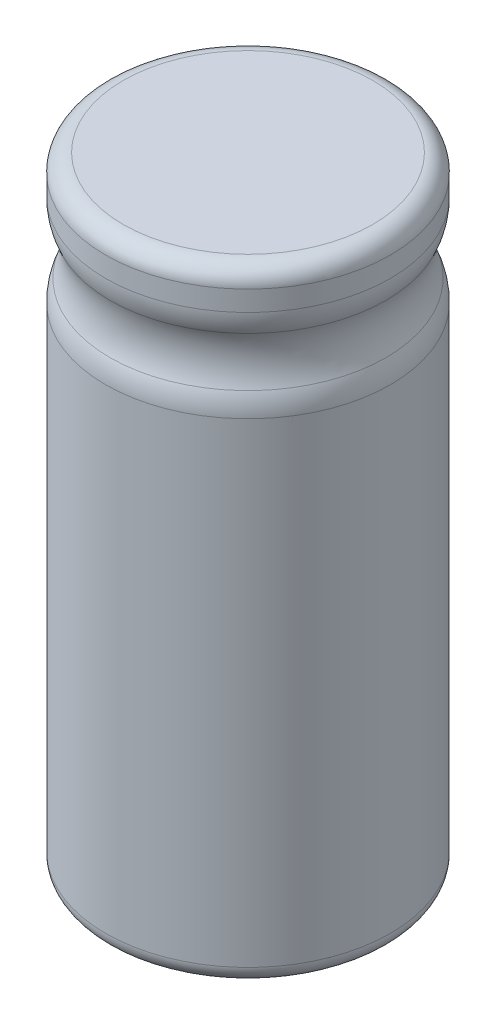
from build123d import *

# Parameters (mm, degrees)
SKETCH1_R           = 16.125
BOSS_EXTRUDE1_DEPTH = 35.25
FILLET1_R           = 2
FILLET2_R           = 6


with BuildPart() as part:
    # Sketch1 → Boss-Extrude1 (new, symmetric)
    with BuildSketch(Plane(origin=(0, 0, 0), x_dir=(1, 0, 0), z_dir=(0, 1, 0))):
        with Locations(Location((0, 0, 0), (0, 0, 270))):
            Circle(SKETCH1_R)
    extrude(amount=BOSS_EXTRUDE1_DEPTH, both=True)

    # Fillet1
    fillet1_edges = [part.edges().sort_by_distance(p)[0] for p in [
        (0, -35.25, -16.125),
        (0, 35.25, -16.125),
    ]]
    fillet(fillet1_edges, radius=FILLET1_R)

    # Sketch2 → Cut-Revolve1 (revolve, cut)
    with BuildSketch(Plane.XY, mode=Mode.PRIVATE) as cut_revolve1_sk:
        with BuildLine():
            ThreePointArc((16.125, 22), (15.035795209, 25.75), (16.125, 29.5))
            Line((16.125, 29.5), (16.125, 22))
        make_face()
    revolve(cut_revolve1_sk.sketch.rotate(Axis((0, 35.25, 0), (0, -1, 0)), 90), axis=Axis((0, 35.25, 0), (0, -1, 0)), mode=Mode.SUBTRACT)

    # Fillet2
    fillet2_edges = [part.edges().sort_by_distance(p)[0] for p in [
        (0, 29.5, -16.125),
        (0, 22, -16.125),
    ]]
    fillet(fillet2_edges, radius=FILLET2_R)


solid = part.part
